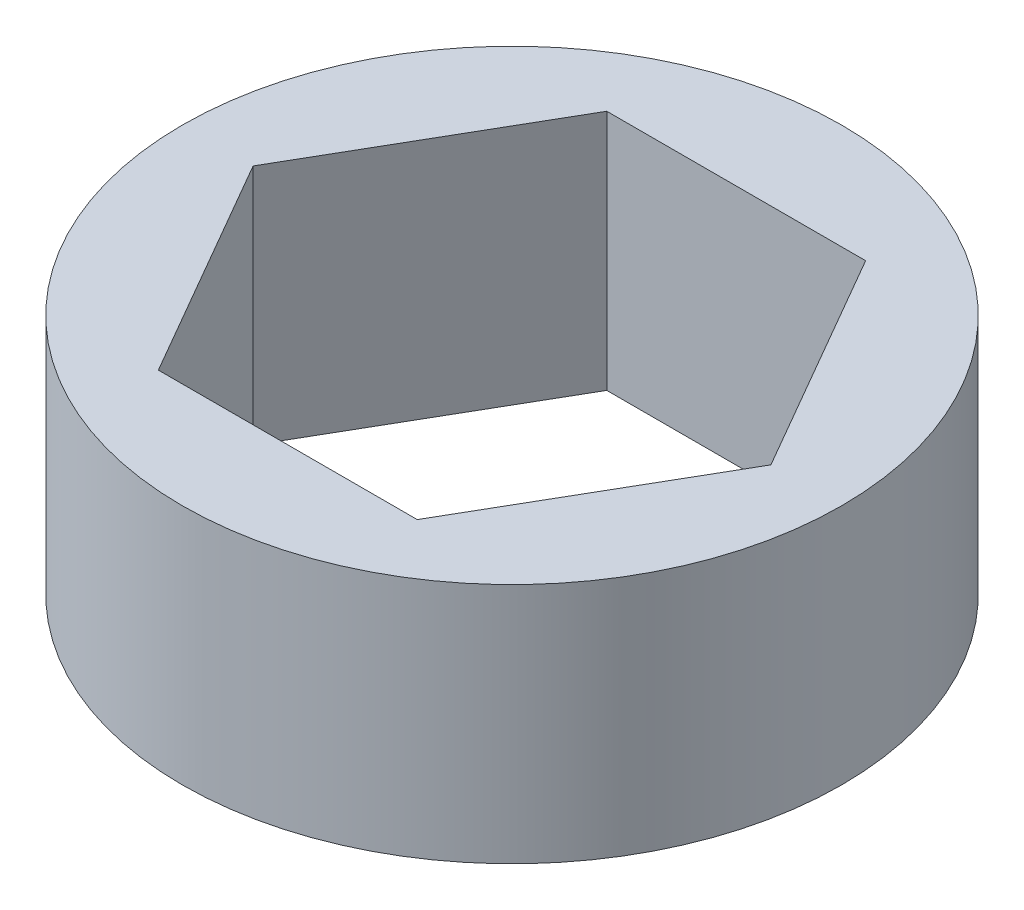
from build123d import *

# Parameters (mm, degrees)
SKETCH1_R           = 9.525
BOSS_EXTRUDE1_DEPTH = 63.5
CUT_EXTRUDE2_START  = -56.515
SKETCH3_R           = 9.525
CUT_EXTRUDE2_DEPTH  = 56.515


with BuildPart() as part:
    # Sketch1 → Boss-Extrude1 (new body)
    with BuildSketch(Plane(origin=(0, 0, 0), x_dir=(1, 0, 0), z_dir=(0, 1, 0))):
        with Locations(Location((0, 0, 0), (0, 0, 270))):
            Circle(SKETCH1_R)
        Polygon((7.478995387, 0), (3.739497694, 6.477), (-3.739497694, 6.477), (-7.478995387, 0), (-3.739497694, -6.477), (3.739497694, -6.477), align=None, mode=Mode.SUBTRACT)
    extrude(amount=BOSS_EXTRUDE1_DEPTH)

    # Sketch3 → Cut-Extrude2 (cut)
    with BuildSketch(Plane(origin=(0, 63.5, 0), x_dir=(1, 0, 0), z_dir=(0, 1, 0)).offset(CUT_EXTRUDE2_START)):
        with Locations(Location((0, 0, 0), (0, 0, 270))):
            Circle(SKETCH3_R)
    extrude(amount=CUT_EXTRUDE2_DEPTH, mode=Mode.SUBTRACT)


solid = part.part
